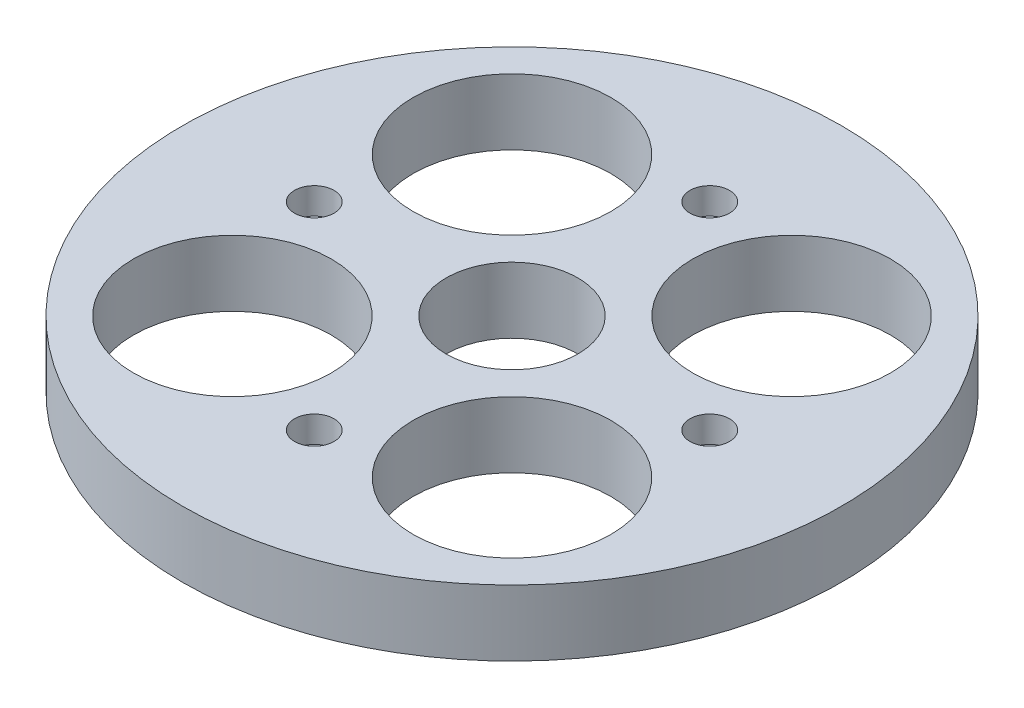
from build123d import *

# Parameters (mm, degrees)
SKETCH_2_R          = 50
SKETCH_2_R_2        = 30
SKETCH_2_R_3        = 10
EXTRUDE_1_DEPTH     = 10
SKETCH_3_R          = 3
CUT_EXTRUDE_1_DEPTH = 4
SKETCH_4_R          = 1.5
CUT_EXTRUDE_2_DEPTH = 71.964779997
CUT_EXTRUDE_START   = -3
SKETCH_5_R          = 3
CUT_EXTRUDE_3_DEPTH = 3
SKETCH_6_R          = 15
CUT_EXTRUDE_5_DEPTH = 72.414284285


with BuildPart() as part:
    # 草图2 → 凸台-拉伸1 (new body)
    # profile 1 of 2: a face of its own
    with BuildSketch(Plane(origin=(0, 0, 0), x_dir=(1, 0, 0), z_dir=(0, 1, 0))):
        with Locations(Location((0, 0, 0), (0, 0, 270))):
            Circle(SKETCH_2_R)
        Circle(SKETCH_2_R_2, mode=Mode.SUBTRACT)
    # profile 2 of 2: a face of its own
    with BuildSketch(Plane(origin=(0, 0, 0), x_dir=(1, 0, 0), z_dir=(0, 1, 0))):
        Circle(SKETCH_2_R_2)
        with Locations(Location((0, 0, 0), (0, 0, 270))):
            Circle(SKETCH_2_R_3, mode=Mode.SUBTRACT)
    extrude(amount=EXTRUDE_1_DEPTH)

    # 草图3 → 切除-拉伸1 (cut)
    with BuildSketch(Plane(origin=(0, 10, 0), x_dir=(1, 0, 0), z_dir=(0, 1, 0))):
        with Locations(Location((0, 30, 0), (0, 0, 270))):
            Circle(SKETCH_3_R)
        with Locations(Location((30, 0, 0), (0, 0, 270))):
            Circle(SKETCH_3_R)
        with Locations(Location((0, -30, 0), (0, 0, 270))):
            Circle(SKETCH_3_R)
        with Locations(Location((-30, 0, 0), (0, 0, 270))):
            Circle(SKETCH_3_R)
    extrude(amount=-CUT_EXTRUDE_1_DEPTH, mode=Mode.SUBTRACT)

    # 草图4 → 切除-拉伸2 (cut, through all)
    with BuildSketch(Plane(origin=(0, 6, 0), x_dir=(1, 0, 0), z_dir=(0, 1, 0))):
        with Locations(Location((0, 30, 0), (0, 0, 270))):
            Circle(SKETCH_4_R)
        with Locations(Location((30, 0, 0), (0, 0, 270))):
            Circle(SKETCH_4_R)
        with Locations(Location((0, -30, 0), (0, 0, 270))):
            Circle(SKETCH_4_R)
        with Locations(Location((-30, 0, 0), (0, 0, 270))):
            Circle(SKETCH_4_R)
    extrude(amount=-CUT_EXTRUDE_2_DEPTH, mode=Mode.SUBTRACT)

    # 草图5 → 切除-拉伸3 (cut)
    with BuildSketch(Plane.XZ.offset(CUT_EXTRUDE_START)):
        with Locations(Location((0, 30, 0), (0, 0, 90))):
            Circle(SKETCH_5_R)
        with Locations(Location((30, 0, 0), (0, 0, 90))):
            Circle(SKETCH_5_R)
        with Locations(Location((0, -30, 0), (0, 0, 90))):
            Circle(SKETCH_5_R)
        with Locations(Location((-30, 0, 0), (0, 0, 90))):
            Circle(SKETCH_5_R)
    extrude(amount=CUT_EXTRUDE_3_DEPTH, mode=Mode.SUBTRACT)

    # 草图6 → 切除-拉伸5 (cut, through all)
    with BuildSketch(Plane(origin=(0, 10, 0), x_dir=(1, 0, 0), z_dir=(0, 1, 0))):
        with Locations(Location((-21.213203436, 21.213203436, 0), (0, 0, 270))):
            Circle(SKETCH_6_R)
        with BuildLine():
            ThreePointArc((36.213203436, 21.213203436), (35.071396428, 26.953454911), (31.819805169, 31.819805138))
            Line((31.819805153, 31.819805153), (10.606601718, 10.606601718))
            ThreePointArc((10.606601715, 10.606601721), (26.953454919, 7.355010447), (36.213203436, 21.213203436))
        make_face()
        with BuildLine():
            Line((10.606601718, 10.606601718), (31.819805153, 31.819805153))
            ThreePointArc((31.819805169, 31.819805138), (10.606601727, 31.819805163), (10.606601715, 10.606601721))
        make_face()
        with Locations(Location((21.213203436, -21.213203436, 0), (0, 0, 270))):
            Circle(SKETCH_6_R)
        with BuildLine():
            ThreePointArc((-10.60660172, -10.606601716), (-31.819805167, -10.606601732), (-31.819805128, -31.819805179))
            Line((-31.819805153, -31.819805153), (-10.606601718, -10.606601718))
        make_face()
        with BuildLine():
            Line((-10.606601718, -10.606601718), (-31.819805153, -31.819805153))
            ThreePointArc((-31.819805128, -31.819805179), (-15.472951933, -35.071396416), (-6.213203436, -21.213203436))
            ThreePointArc((-6.213203436, -21.213203436), (-7.355010448, -15.472951949), (-10.60660172, -10.606601716))
        make_face()
    extrude(amount=-CUT_EXTRUDE_5_DEPTH, mode=Mode.SUBTRACT)


solid = part.part
